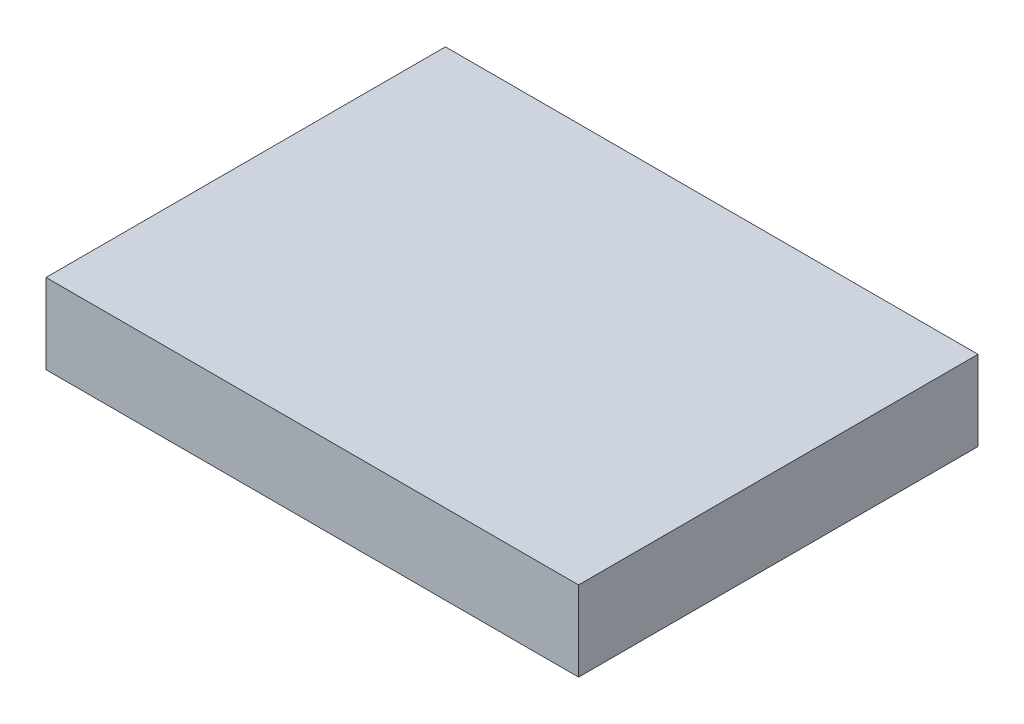
from build123d import *

# Parameters (mm, degrees)
SKETCH_1_W      = 20
SKETCH_1_H      = 15
EXTRUDE_1_DEPTH = 3


with BuildPart() as part:
    # Эскиз1 → Бобышка-Вытянуть1 (new body)
    with BuildSketch(Plane(origin=(0, 0, 0), x_dir=(1, 0, 0), z_dir=(0, 1, 0))):
        Rectangle(SKETCH_1_W, SKETCH_1_H)
    extrude(amount=EXTRUDE_1_DEPTH)


solid = part.part
